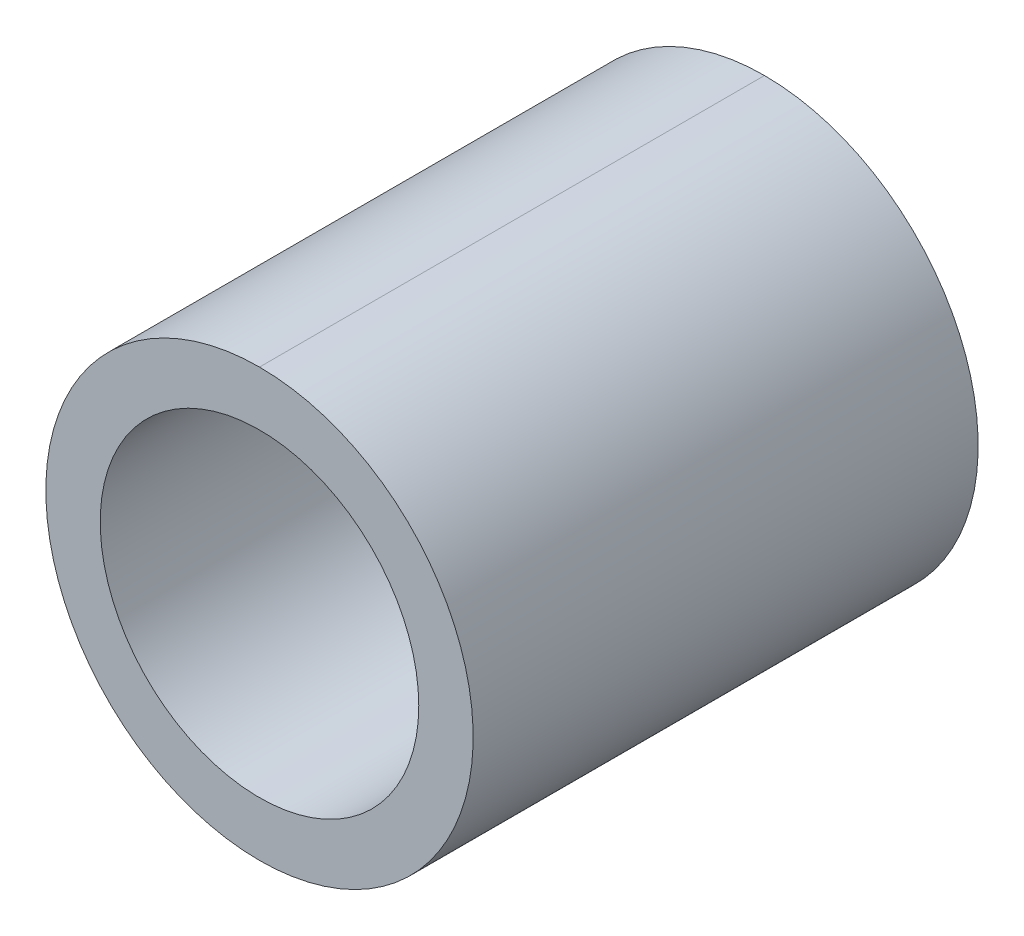
from build123d import *

# Parameters (mm, degrees)
SKETCH1_R           = 55
BOSS_EXTRUDE1_DEPTH = 130
SKETCH2_R           = 41
CUT_EXTRUDE1_DEPTH  = 120


with BuildPart() as part:
    # Sketch1 → Boss-Extrude1 (new body)
    with BuildSketch(Plane.XY):
        Circle(SKETCH1_R)
    extrude(amount=BOSS_EXTRUDE1_DEPTH)

    # Sketch2 → Cut-Extrude1 (cut)
    with BuildSketch(Plane.XY.offset(130)):
        Circle(SKETCH2_R)
    extrude(amount=-CUT_EXTRUDE1_DEPTH, mode=Mode.SUBTRACT)


solid = part.part
